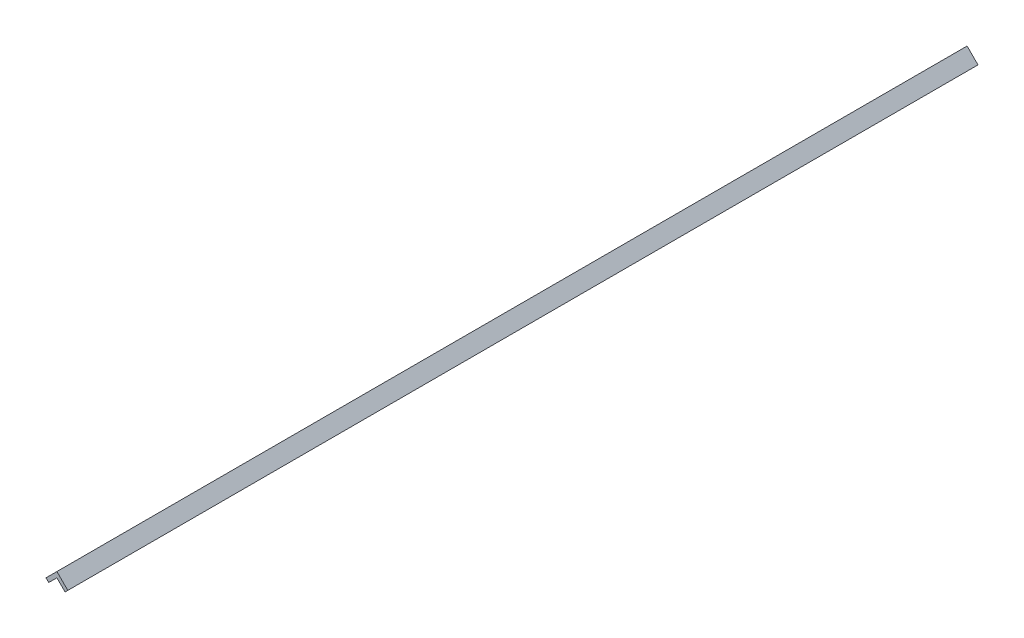
from build123d import *


with BuildPart() as part:
    # Varredura1: sweep along a path in Esboço2
    with BuildLine(Plane(origin=(0, 0, 0), x_dir=(1, 0, 0), z_dir=(0, 1, 0))) as varredura1_path:
        Line((0, 0), (0, -750))
    # Esboço1 → Varredura1 (sweep)
    with BuildSketch(Plane.XY):
        Polygon((0, 11.228855685), (8.980256121, 2.248599564), (6.731656557, 0), (0, 6.731656557), (-6.731656557, 0), (-8.980256121, 2.248599564), align=None)
    sweep(path=varredura1_path.line)


solid = part.part
